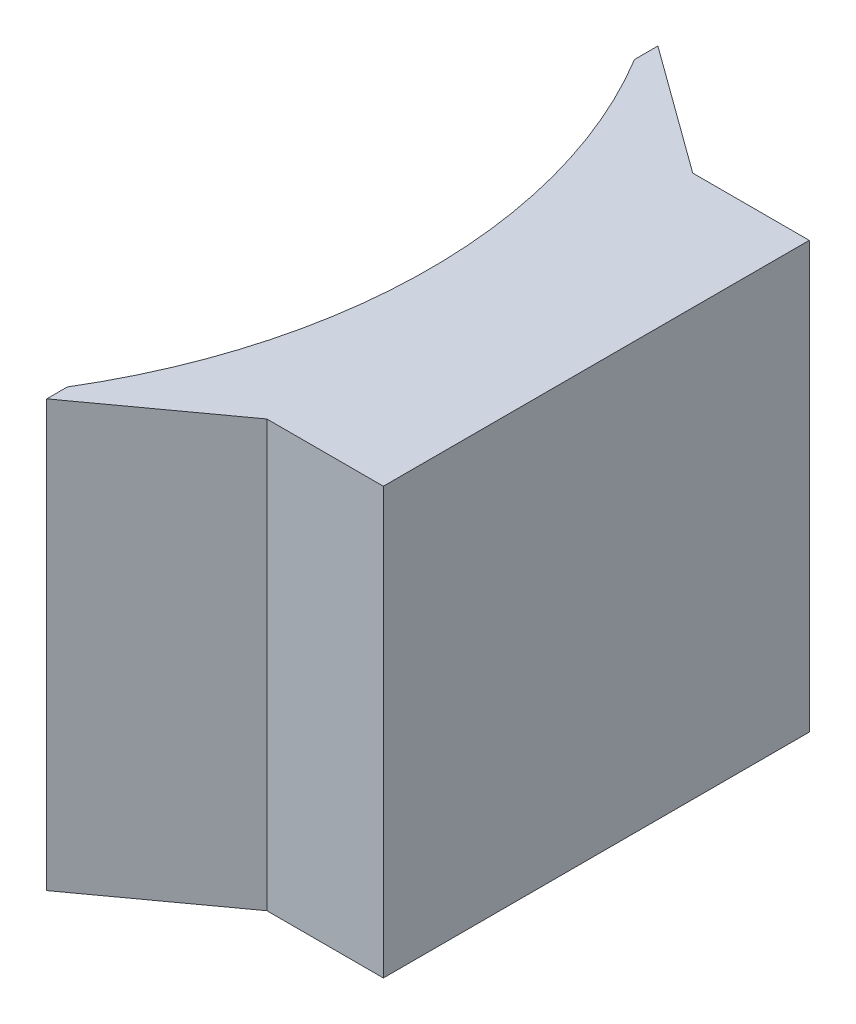
from build123d import *

# Parameters (mm, degrees)
SKETCH1_W           = 53
SKETCH1_H           = 53
BOSS_EXTRUDE1_DEPTH = 14.5
BOSS_EXTRUDE2_DEPTH = 53
SKETCH5_R           = 68.311173766
CUT_EXTRUDE1_DEPTH  = 60
SCALE1_SCALE        = 4


with BuildPart() as part:
    # Sketch1 → Boss-Extrude1 (new body)
    with BuildSketch(Plane(origin=(0, 0, 0), x_dir=(0, 0, -1), z_dir=(1, 0, 0))):
        with Locations((-26.5, -26.5)):
            Rectangle(SKETCH1_W, SKETCH1_H)
    extrude(amount=BOSS_EXTRUDE1_DEPTH)

    # Sketch2 → Boss-Extrude2 (add)
    with BuildSketch(Plane.XZ.offset(53)):
        Polygon((0, 53), (-15.864497794, 64.526232333), (-15.864497794, -11.526232333), (0, 0), align=None)
    extrude(amount=-BOSS_EXTRUDE2_DEPTH)

    # Sketch5 → Cut-Extrude1 (cut)
    with BuildSketch(Plane(origin=(0, 0, 0), x_dir=(1, 0, 0), z_dir=(0, 1, 0))):
        with Locations((-74.352498141, -26.670023257)):
            Circle(SKETCH5_R)
    extrude(amount=-CUT_EXTRUDE1_DEPTH, mode=Mode.SUBTRACT)


with BuildPart() as part_1:
    # Scale1: scaled about (0, 0, 0)
    add(part.part.scale(SCALE1_SCALE))


solid = part_1.part
